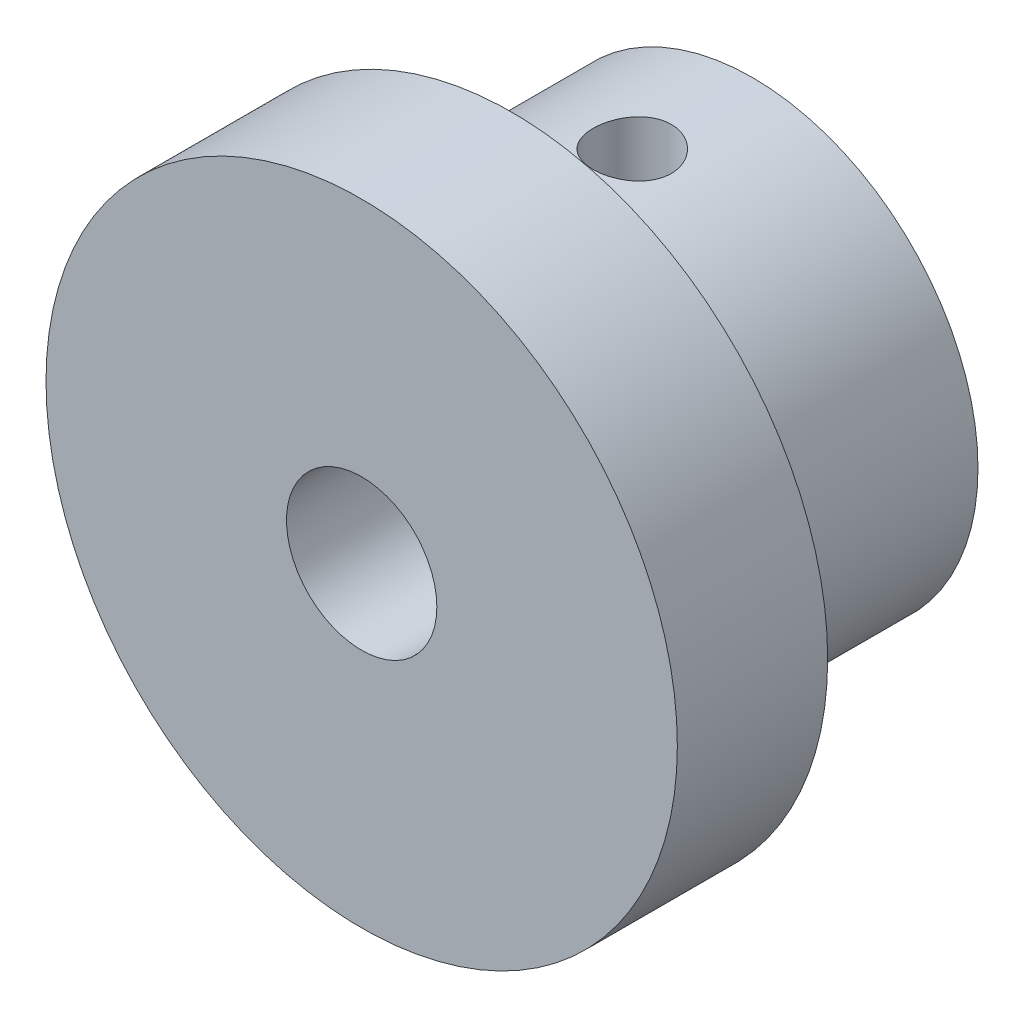
from build123d import *

# Parameters (mm, degrees)
SKETCH1_R                        = 7.5
BOSS_EXTRUDE1_DEPTH              = 8
SKETCH2_R                        = 10.5
BOSS_EXTRUDE2_DEPTH              = 5
SKETCH3_R                        = 2.5
CUT_EXTRUDE1_DEPTH               = 20.735754356
TAP_DRILL_FOR_M3X0_5_TAP1_REACH  = 24.699
TAP_DRILL_FOR_M3X0_5_TAP1_BORE_R = 1.3


with BuildPart() as part:
    # Sketch1 → Boss-Extrude1 (new body)
    with BuildSketch(Plane.XY):
        Circle(SKETCH1_R)
    extrude(amount=BOSS_EXTRUDE1_DEPTH)

    # Sketch2 → Boss-Extrude2 (add)
    with BuildSketch(Plane.XY.offset(8)):
        Circle(SKETCH2_R)
    extrude(amount=BOSS_EXTRUDE2_DEPTH)

    # Sketch3 → Cut-Extrude1 (cut, through all)
    with BuildSketch(Plane.XY.offset(13)):
        Circle(SKETCH3_R)
    extrude(amount=-CUT_EXTRUDE1_DEPTH, mode=Mode.SUBTRACT)

    # Tap Drill for M3x0.5 Tap1 bore (on position points) → Tap Drill for M3x0.5 Tap1 (cut, up to next)
    with BuildSketch(Plane(origin=(0, 7.5, 4), x_dir=(1, 0, 0), z_dir=(0, 1, 0)), mode=Mode.PRIVATE) as tap_drill_for_m3x0_5_tap1_sk1:
        Circle(TAP_DRILL_FOR_M3X0_5_TAP1_BORE_R)
    tap_drill_for_m3x0_5_tap1_tool1 = extrude(tap_drill_for_m3x0_5_tap1_sk1.sketch, amount=-TAP_DRILL_FOR_M3X0_5_TAP1_REACH, mode=Mode.PRIVATE) & part.part
    add(tap_drill_for_m3x0_5_tap1_tool1.solids().sort_by_distance((0, 7.5, 4))[0], mode=Mode.SUBTRACT)


solid = part.part
